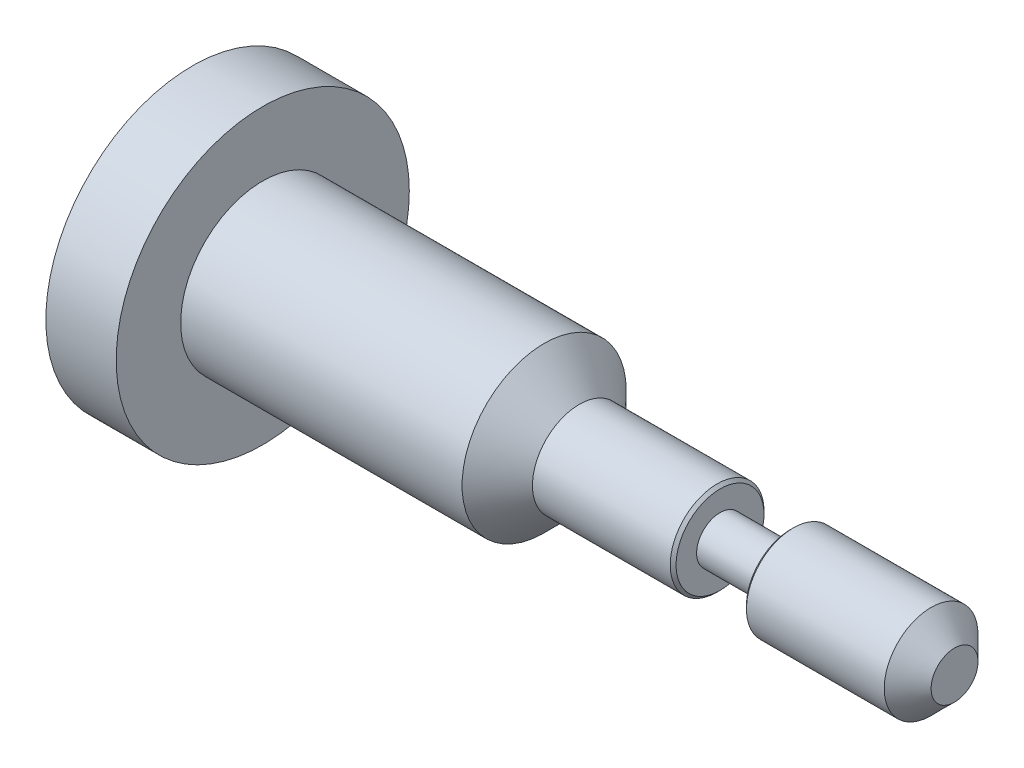
from build123d import *


with BuildPart() as part:
    # Sketch1 → Revolve1 (revolve)
    with BuildSketch(Plane.XY, mode=Mode.PRIVATE) as revolve1_sk:
        Polygon((0, 0), (0, 1.5), (-1.5, 5), (-1.5, 6.25), (1.5, 6.25), (1.5, 3.5), (13.5, 3.5), (15, 2), (20.875, 2), (21, 1.875), (21, 1), (24, 1), (24, 1.875), (24.125, 2), (30, 2), (31, 1), (31, 0), align=None)
    revolve(revolve1_sk.sketch.rotate(Axis((31, 0, 0), (-1, 0, 0)), 90), axis=Axis((31, 0, 0), (-1, 0, 0)))


solid = part.part
